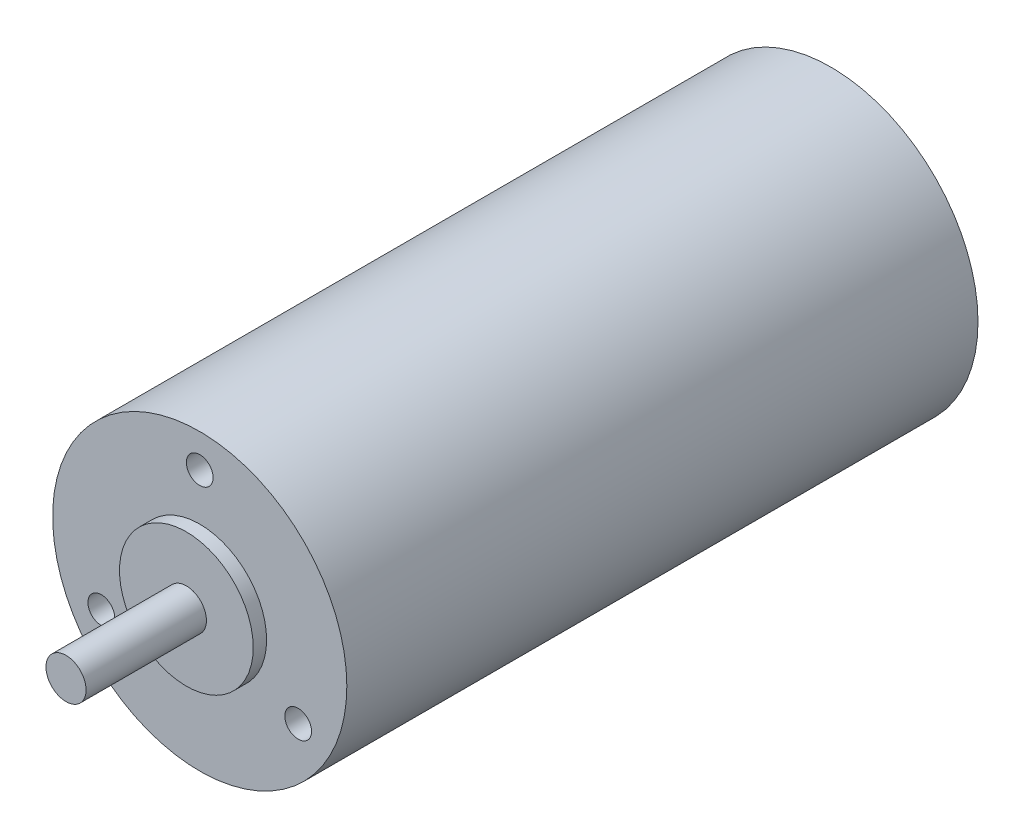
from build123d import *

# Parameters (mm, degrees)
SKETCH1_R           = 11
BOSS_EXTRUDE1_DEPTH = 47.2
SKETCH2_R           = 5
BOSS_EXTRUDE2_DEPTH = 1
SKETCH3_R           = 1.5
BOSS_EXTRUDE3_DEPTH = 10
SKETCH4_R           = 1
CUT_EXTRUDE1_DEPTH  = 2.5


with BuildPart() as part:
    # Sketch1 → Boss-Extrude1 (new body)
    with BuildSketch(Plane.XY):
        Circle(SKETCH1_R)
    extrude(amount=-BOSS_EXTRUDE1_DEPTH)

    # Sketch2 → Boss-Extrude2 (add)
    with BuildSketch(Plane.XY):
        Circle(SKETCH2_R)
    extrude(amount=BOSS_EXTRUDE2_DEPTH)

    # Sketch3 → Boss-Extrude3 (add)
    with BuildSketch(Plane.XY):
        Circle(SKETCH3_R)
    extrude(amount=BOSS_EXTRUDE3_DEPTH)

    # Sketch4 → Cut-Extrude1 (cut)
    with BuildSketch(Plane.XY):
        with Locations((0, 8.5)):
            Circle(SKETCH4_R)
        with Locations((7.361215932, -4.25)):
            Circle(SKETCH4_R)
        with Locations((-7.361215932, -4.25)):
            Circle(SKETCH4_R)
    extrude(amount=-CUT_EXTRUDE1_DEPTH, mode=Mode.SUBTRACT)


solid = part.part
